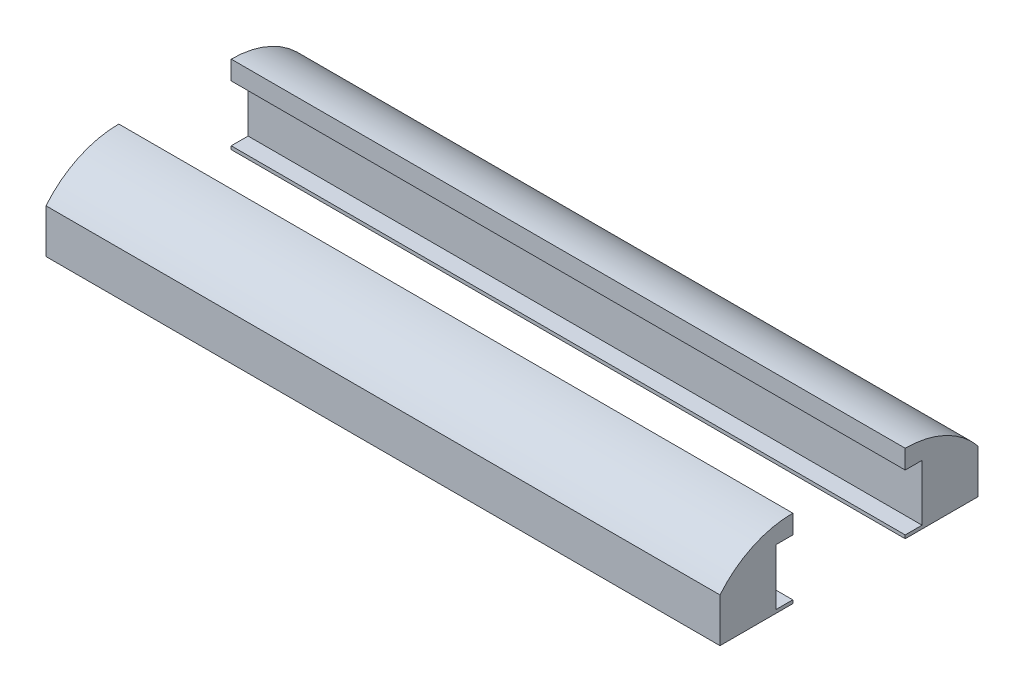
from build123d import *

# Parameters (mm, degrees)
BOSS_EXTRUDE1_DEPTH   = 120
BOSS_EXTRUDE1_2_DEPTH = 120


with BuildPart() as part:
    # Sketch3 → Boss-Extrude1 (new body)
    with BuildSketch(Plane(origin=(0, 0, -10), x_dir=(0, 0, -1), z_dir=(1, 0, 0))):
        with BuildLine():
            Line((0.008344509, 0), (12.968344509, 0))
            Line((12.968344509, 0), (12.968344509, 7.83))
            ThreePointArc((12.968344509, 7.83), (7.176651492, 12.350213458), (0.008344509, 13.96))
            Line((0.008344509, 13.96), (0.008344509, 10.59476024))
            Line((0.008344509, 10.59476024), (3.008344509, 10.59476024))
            Line((3.008344509, 10.59476024), (3.008344509, 0.59476024))
            Line((3.008344509, 0.59476024), (0.008344509, 0.59476024))
            Line((0.008344509, 0.59476024), (0.008344509, 0))
        make_face()
    extrude(amount=BOSS_EXTRUDE1_DEPTH)


with BuildPart() as body_2:
    # Sketch3 → Boss-Extrude1 2 (new body)
    with BuildSketch(Plane(origin=(0, 0, -10), x_dir=(0, 0, -1), z_dir=(1, 0, 0))):
        with BuildLine():
            Line((-20.008344509, 10.59476024), (-20.008344509, 13.96))
            ThreePointArc((-20.008344509, 13.96), (-27.176651492, 12.350213458), (-32.968344509, 7.83))
            Line((-32.968344509, 7.83), (-32.968344509, 0))
            Line((-32.968344509, 0), (-20.008344509, 0))
            Line((-20.008344509, 0), (-20.008344509, 0.59476024))
            Line((-20.008344509, 0.59476024), (-23.008344509, 0.59476024))
            Line((-23.008344509, 0.59476024), (-23.008344509, 10.59476024))
            Line((-23.008344509, 10.59476024), (-20.008344509, 10.59476024))
        make_face()
    extrude(amount=BOSS_EXTRUDE1_2_DEPTH)


solid = Compound([part.part, body_2.part])
